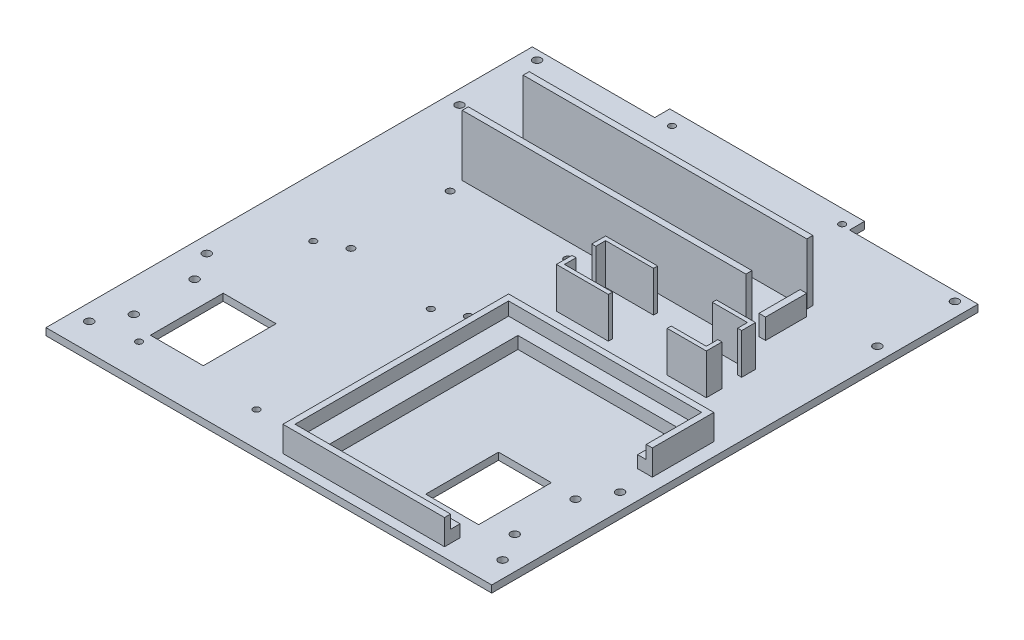
from build123d import *

# Parameters (mm, degrees)
SKETCH_1_W           = 220
SKETCH_1_H           = 240
EXTRUDE_2_DEPTH      = 3.5
SKETCH_2_R           = 2
CUT_EXTRUDE_2_DEPTH  = 3.5
SKETCH_3_R           = 2
CUT_EXTRUDE_3_DEPTH  = 3.5
SKETCH_5_R           = 1.6
CUT_EXTRUDE_4_DEPTH  = 5
EXTRUDE_5_DEPTH      = 6
EXTRUDE_6_DEPTH      = 6.5
EXTRUDE_6_DEPTH_BACK = 6.6
SKETCH_10_R          = 1.6
CUT_EXTRUDE_5_DEPTH  = 6.5
SKETCH_11_W          = 140
SKETCH_11_H          = 3
EXTRUDE_7_DEPTH      = 30
SKETCH_12_W          = 3.232393119
SKETCH_12_H          = 20.299160217
EXTRUDE_8_DEPTH      = 10
SKETCH_13_W          = 2.764768701
SKETCH_13_H          = 11.651525239
EXTRUDE_9_DEPTH      = 10
SKETCH_16_W          = 96.137938664
SKETCH_16_H          = 7.416001845
EXTRUDE_10_DEPTH     = 3.5
SKETCH_17_R          = 1.6
EXTRUDE_11_DEPTH     = 3.5
SKETCH_18_R          = 1.6
CUT_EXTRUDE_7_DEPTH  = 10
SKETCH_19_R          = 1.75
CUT_EXTRUDE_8_DEPTH  = 10
SKETCH_20_W          = 74
SKETCH_20_H          = 24.3
SKETCH_20_W_2        = 70
SKETCH_20_H_2        = 20.3
EXTRUDE_12_DEPTH     = 20
SKETCH_21_W          = 74
SKETCH_21_H          = 9.741779049
CUT_EXTRUDE_9_DEPTH  = 20
SKETCH_22_W          = 29.010965049
SKETCH_22_H          = 24.3
CUT_EXTRUDE_10_DEPTH = 20
SKETCH_23_W          = 26.105014581
SKETCH_23_H          = 35.922285021
CUT_EXTRUDE_11_DEPTH = 20


with BuildPart() as part:
    # 草图1 → 凸台-拉伸2 (new body)
    with BuildSketch(Plane(origin=(0, 0, 0), x_dir=(1, 0, 0), z_dir=(0, 1, 0))):
        with Locations((0, 20)):
            Rectangle(SKETCH_1_W, SKETCH_1_H)
    extrude(amount=EXTRUDE_2_DEPTH)

    # 草图2 → 切除-拉伸2 (cut)
    with BuildSketch(Plane(origin=(0, 3.5, 0), x_dir=(1, 0, 0), z_dir=(0, 1, 0))):
        with Locations(Location((-102, -28.658278573, 0), (0, 0, 270))):
            Circle(SKETCH_2_R)
        with Locations(Location((-102, -86.658278573, 0), (0, 0, 270))):
            Circle(SKETCH_2_R)
        with Locations(Location((-94, -42.658278573, 0), (0, 0, 270))):
            Circle(SKETCH_2_R)
        with Locations(Location((-94, -72.658278573, 0), (0, 0, 270))):
            Circle(SKETCH_2_R)
        with Locations(Location((94, -72.658278573, 0), (0, 0, 90))):
            Circle(SKETCH_2_R)
        with Locations(Location((94, -42.658278573, 0), (0, 0, 90))):
            Circle(SKETCH_2_R)
        with Locations(Location((102, -86.658278573, 0), (0, 0, 90))):
            Circle(SKETCH_2_R)
        with Locations(Location((102, -28.658278573, 0), (0, 0, 90))):
            Circle(SKETCH_2_R)
    extrude(amount=-CUT_EXTRUDE_2_DEPTH, mode=Mode.SUBTRACT)

    # 草图3 → 切除-拉伸3 (cut)
    with BuildSketch(Plane(origin=(0, 3.5, 0), x_dir=(1, 0, 0), z_dir=(0, 1, 0))):
        with Locations(Location((-103.111804302, 135.498442221, 0), (0, 0, 270))):
            Circle(SKETCH_3_R)
        with Locations(Location((-103.111804302, 97.198442221, 0), (0, 0, 270))):
            Circle(SKETCH_3_R)
        with Locations(Location((103.111804302, 97.198442221, 0), (0, 0, 90))):
            Circle(SKETCH_3_R)
        with Locations(Location((103.111804302, 135.498442221, 0), (0, 0, 90))):
            Circle(SKETCH_3_R)
    extrude(amount=-CUT_EXTRUDE_3_DEPTH, mode=Mode.SUBTRACT)

    # 草图5 → 切除-拉伸4 (cut)
    with BuildSketch(Plane(origin=(0, 3.5, 0), x_dir=(1, 0, 0), z_dir=(0, 1, 0))):
        with Locations(Location((-81.020690523, 2.946124731, 0), (0, 0, 270))):
            Circle(SKETCH_5_R)
        with Locations(Location((-23.020690523, 2.946124731, 0), (0, 0, 270))):
            Circle(SKETCH_5_R)
        with Locations(Location((-81.020690523, -83.053875269, 0), (0, 0, 270))):
            Circle(SKETCH_5_R)
        with Locations(Location((-23.020690523, -83.053875269, 0), (0, 0, 270))):
            Circle(SKETCH_5_R)
    extrude(amount=-CUT_EXTRUDE_4_DEPTH, mode=Mode.SUBTRACT)

    # 草图6 → 凸台-拉伸5 (add)
    with BuildSketch(Plane(origin=(0, 3.5, 0), x_dir=(1, 0, 0), z_dir=(0, 1, 0))):
        Polygon((5.262523113, 13.061457841), (5.262523113, -92.338542159), (82.027739865, -92.338542159), (82.027739865, -87.674935575), (15.799538285, -87.674935575), (15.799538285, 7.122294137), (18.613154692, 7.122294137), (82.027739865, 7.122294137), (96.312253931, 7.122294137), (96.312253931, -14.304476962), (100.562523113, -14.304476962), (100.562523113, 13.061457841), align=None)
    extrude(amount=EXTRUDE_5_DEPTH)

    # 草图9 → 凸台-拉伸6 (add, two sides: drawn at the far end of the back side and taken through both)
    with BuildSketch(Plane(origin=(0, 9.5, 0), x_dir=(1, 0, 0), z_dir=(0, 1, 0)).offset(-EXTRUDE_6_DEPTH_BACK)):
        Polygon((100.562523113, -14.304476962), (103.562523113, -14.304476962), (103.562523113, 16.061457841), (2.262523113, 16.061457841), (2.262523113, -95.338542159), (82.027739865, -95.338542159), (82.027739865, -92.338542159), (5.262523113, -92.338542159), (5.262523113, 13.061457841), (100.562523113, 13.061457841), align=None)
    extrude(amount=EXTRUDE_6_DEPTH + EXTRUDE_6_DEPTH_BACK)

    # 草图10 → 切除-拉伸5 (cut)
    with BuildSketch(Plane(origin=(0, 3.5, 0), x_dir=(1, 0, 0), z_dir=(0, 1, 0))):
        with Locations(Location((-41.742355154, 136.315932828, 0), (0, 0, 270))):
            Circle(SKETCH_10_R)
        with Locations(Location((42.257644846, 136.315932828, 0), (0, 0, 270))):
            Circle(SKETCH_10_R)
        with Locations(Location((42.257644846, 106.015932828, 0), (0, 0, 270))):
            Circle(SKETCH_10_R)
        with Locations(Location((-41.742355154, 106.015932828, 0), (0, 0, 270))):
            Circle(SKETCH_10_R)
    extrude(amount=-CUT_EXTRUDE_5_DEPTH, mode=Mode.SUBTRACT)

    # 草图11 → 凸台-拉伸7 (add)
    with BuildSketch(Plane(origin=(0, 3.5, 0), x_dir=(1, 0, 0), z_dir=(0, 1, 0))):
        with Locations((-0.160177845, 97.161173923)):
            Rectangle(SKETCH_11_W, SKETCH_11_H)
        with Locations((-0.160177845, 67.099391039)):
            Rectangle(SKETCH_11_W, SKETCH_11_H)
    extrude(amount=EXTRUDE_7_DEPTH)

    # 草图12 → 凸台-拉伸8 (add)
    with BuildSketch(Plane(origin=(0, 3.5, 0), x_dir=(1, 0, 0), z_dir=(0, 1, 0))):
        with Locations((71.456018715, 82.21636334)):
            Rectangle(SKETCH_12_W, SKETCH_12_H)
    extrude(amount=EXTRUDE_8_DEPTH)

    # 草图13 → 凸台-拉伸9 (add)
    with BuildSketch(Plane(origin=(0, 3.5, 0), x_dir=(1, 0, 0), z_dir=(0, 1, 0))):
        with Locations((-72.199784206, 82.73648821)):
            Rectangle(SKETCH_13_W, SKETCH_13_H)
    extrude(amount=EXTRUDE_9_DEPTH)

    # 草图16 → 凸台-拉伸10 (add)
    with BuildSketch(Plane(origin=(0, 3.5, 0), x_dir=(1, 0, 0), z_dir=(0, 1, 0))):
        with Locations((-1.491522008, 143.708000922)):
            Rectangle(SKETCH_16_W, SKETCH_16_H)
    extrude(amount=-EXTRUDE_10_DEPTH)

    # 草图17 → 凸台-拉伸11 (add)
    with BuildSketch(Plane(origin=(0, 3.5, 0), x_dir=(1, 0, 0), z_dir=(0, 1, 0))):
        with Locations((-41.742355154, 136.315932828)):
            Circle(SKETCH_17_R)
        with Locations((-41.742355154, 106.015932828)):
            Circle(SKETCH_17_R)
        with Locations((42.257644846, 106.015932828)):
            Circle(SKETCH_17_R)
        with Locations((42.257644846, 136.315932828)):
            Circle(SKETCH_17_R)
    extrude(amount=-EXTRUDE_11_DEPTH)

    # 草图18 → 切除-拉伸7 (cut)
    with BuildSketch(Plane(origin=(0, 3.5, 0), x_dir=(1, 0, 0), z_dir=(0, 1, 0))):
        with Locations(Location((-41.742355154, 140.688952656, 0), (0, 0, 270))):
            Circle(SKETCH_18_R)
        with Locations(Location((-41.742355154, 110.388952656, 0), (0, 0, 270))):
            Circle(SKETCH_18_R)
        with Locations(Location((42.257644846, 110.388952656, 0), (0, 0, 270))):
            Circle(SKETCH_18_R)
        with Locations(Location((42.257644846, 140.688952656, 0), (0, 0, 270))):
            Circle(SKETCH_18_R)
    extrude(amount=-CUT_EXTRUDE_7_DEPTH, mode=Mode.SUBTRACT)

    # 草图19 → 切除-拉伸8 (cut)
    with BuildSketch(Plane(origin=(0, 3.5, 0), x_dir=(1, 0, 0), z_dir=(0, 1, 0))):
        with Locations(Location((-10.609897324, 58.100897113, 0), (0, 0, 270))):
            Circle(SKETCH_19_R)
        with Locations(Location((-68.609897324, 58.100897113, 0), (0, 0, 270))):
            Circle(SKETCH_19_R)
        with Locations(Location((-68.609897324, 9.100897113, 0), (0, 0, 270))):
            Circle(SKETCH_19_R)
        with Locations(Location((-10.609897324, 9.100897113, 0), (0, 0, 270))):
            Circle(SKETCH_19_R)
    extrude(amount=-CUT_EXTRUDE_8_DEPTH, mode=Mode.SUBTRACT)

    # 草图20 → 凸台-拉伸12 (add)
    with BuildSketch(Plane(origin=(0, 3.5, 0), x_dir=(1, 0, 0), z_dir=(0, 1, 0))):
        with Locations((45.932869354, 45.125549951)):
            Rectangle(SKETCH_20_W, SKETCH_20_H)
        with Locations((45.932869354, 45.125549951)):
            Rectangle(SKETCH_20_W_2, SKETCH_20_H_2, mode=Mode.SUBTRACT)
    extrude(amount=EXTRUDE_12_DEPTH)

    # 草图21 → 切除-拉伸9 (cut)
    with BuildSketch(Plane(origin=(0, 23.5, 0), x_dir=(1, 0, 0), z_dir=(0, 1, 0))):
        with Locations((45.932869354, 45.559941107)):
            Rectangle(SKETCH_21_W, SKETCH_21_H)
    extrude(amount=-CUT_EXTRUDE_9_DEPTH, mode=Mode.SUBTRACT)

    # 草图22 → 切除-拉伸10 (cut)
    with BuildSketch(Plane(origin=(0, 23.5, 0), x_dir=(1, 0, 0), z_dir=(0, 1, 0))):
        with Locations((49.104478838, 45.125549951)):
            Rectangle(SKETCH_22_W, SKETCH_22_H)
    extrude(amount=-CUT_EXTRUDE_10_DEPTH, mode=Mode.SUBTRACT)

    # 草图23 → 切除-拉伸11 (cut)
    with BuildSketch(Plane(origin=(0, 3.5, 0), x_dir=(1, 0, 0), z_dir=(0, 1, 0))):
        with Locations((-67.939973843, -59.515678039)):
            Rectangle(SKETCH_23_W, SKETCH_23_H)
        with Locations((67.939973843, -59.515678039)):
            Rectangle(SKETCH_23_W, SKETCH_23_H)
    extrude(amount=-CUT_EXTRUDE_11_DEPTH, mode=Mode.SUBTRACT)


solid = part.part
